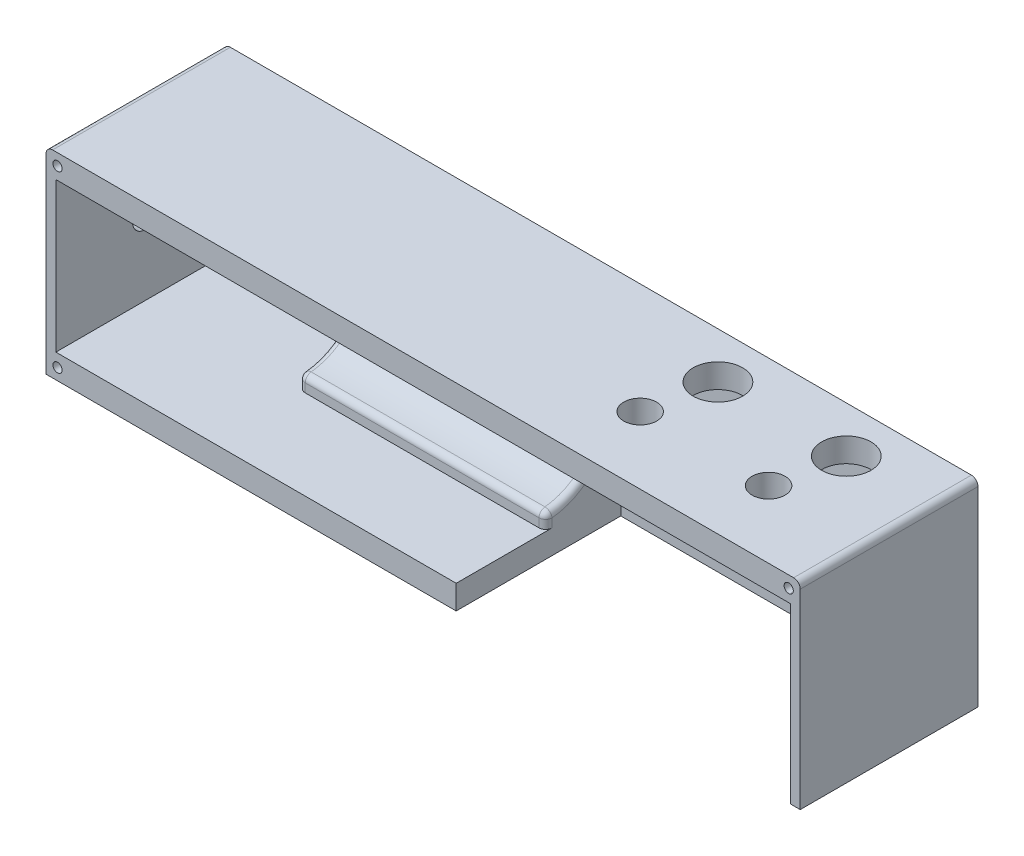
from build123d import *
from build123d.topology import SkipClean

# Parameters (mm, degrees)
SKETCH_1_W          = 46.6
SKETCH_1_H          = 7.3
EXTRUDE_1_DEPTH     = 54
EXTRUDE_1_2_DEPTH   = 54
SKETCH_2_W          = 46.6
SKETCH_2_H          = 45.4
EXTRUDE_2_DEPTH     = 4
SKETCH_3_W          = 54
SKETCH_3_H          = 60
EXTRUDE_3_DEPTH     = 3
SKETCH_4_R          = 3.871689423
CUT_EXTRUDE_1_DEPTH = 3
EXTRUDE_4_DEPTH     = 75
SKETCH_6_W          = 75
SKETCH_6_H          = 7.3
EXTRUDE_5_DEPTH     = 27.146082
SKETCH_7_W          = 4
SKETCH_7_H          = 60
EXTRUDE_6_DEPTH     = 104.5
SKETCH_8_R          = 1.4
CUT_EXTRUDE_2_DEPTH = 75
SKETCH_10_W         = 104.5
SKETCH_10_H         = 50
EXTRUDE_7_DEPTH     = 7.3
SKETCH_11_R         = 7.5
SKETCH_11_R_2       = 5
CUT_EXTRUDE_3_DEPTH = 16
SKETCH_12_W         = 54
SKETCH_12_H         = 60
EXTRUDE_8_DEPTH     = 3
SKETCH_13_R         = 1.4
CUT_EXTRUDE_4_DEPTH = 15
FILLET_1_R          = 2
FILLET_2_R          = 2


with BuildPart() as part:
    # ｽｹｯﾁ1 → ﾎﾞｽ - 押し出し1 (new body)
    with BuildSketch(Plane.XY):
        with Locations((26.3, 3.65)):
            Rectangle(SKETCH_1_W, SKETCH_1_H)
    extrude(amount=EXTRUDE_1_DEPTH)



with BuildPart() as body_2:
    # ｽｹｯﾁ1 → Extrude 1 2 (new body)
    with BuildSketch(Plane.XY):
        with Locations((26.3, 56.35)):
            Rectangle(SKETCH_1_W, SKETCH_1_H)
    extrude(amount=EXTRUDE_1_2_DEPTH)


with BuildPart() as part_1:
    add(part.part)

    add(body_2.part)  # ﾎﾞｽ - 押し出し2 merges body 2
    # ｽｹｯﾁ2 → ﾎﾞｽ - 押し出し2 (add)
    with BuildSketch(Plane(origin=(0, 0, 0), x_dir=(-1, 0, 0), z_dir=(0, 0, -1))):
        with Locations((-26.3, 30)):
            Rectangle(SKETCH_2_W, SKETCH_2_H)
    extrude(amount=-EXTRUDE_2_DEPTH)

    # ｽｹｯﾁ3 → ﾎﾞｽ - 押し出し3 (add)
    with BuildSketch(Plane.ZY.offset(-3)):
        with Locations((27, 30)):
            Rectangle(SKETCH_3_W, SKETCH_3_H)
    extrude(amount=EXTRUDE_3_DEPTH)

    # ｽｹｯﾁ4 → ｶｯﾄ - 押し出し1 (cut)
    with BuildSketch(Plane(origin=(3, 0, 0), x_dir=(0, 0, -1), z_dir=(1, 0, 0))):
        with Locations((-26.853917863, 29.837440161)):
            Circle(SKETCH_4_R)
    extrude(amount=-CUT_EXTRUDE_1_DEPTH, mode=Mode.SUBTRACT)

    # ｽｹｯﾁ5 → ﾎﾞｽ - 押し出し4 (add)
    with BuildSketch(Plane(origin=(49.6, 0, 0), x_dir=(0, 0, -1), z_dir=(1, 0, 0))):
        Polygon((0, 0), (0, 60), (-26.853917863, 60), (-26.853917863, 52.7), (-4, 52.7), (-4, 7.3), (-26.853917863, 7.3), (-26.853917863, 0), align=None)
        with BuildLine():
            Line((-4, 52.7), (-26.853917863, 52.7))
            Line((-26.853917863, 52.7), (-26.853917863, 47.837440161))
            ThreePointArc((-26.853917863, 47.837440161), (-14.125995802, 42.565362223), (-8.853917863, 29.837440161))
            ThreePointArc((-8.853917863, 29.837440161), (-14.125995802, 17.1095181), (-26.853917863, 11.837440161))
            Line((-26.853917863, 11.837440161), (-26.853917863, 7.3))
            Line((-26.853917863, 7.3), (-4, 7.3))
            Line((-4, 7.3), (-4, 52.7))
        make_face()
    extrude(amount=EXTRUDE_4_DEPTH)

    # ｽｹｯﾁ6 → ﾎﾞｽ - 押し出し5 (add)
    with BuildSketch(Plane.XY.offset(26.853917863)):
        with Locations((87.1, 56.35)):
            Rectangle(SKETCH_6_W, SKETCH_6_H)
        with Locations((87.1, 3.65)):
            Rectangle(SKETCH_6_W, SKETCH_6_H)
    extrude(amount=EXTRUDE_5_DEPTH)

    # ｽｹｯﾁ7 → ﾎﾞｽ - 押し出し6 (add)
    with BuildSketch(Plane(origin=(124.6, 0, 0), x_dir=(0, 0, -1), z_dir=(1, 0, 0))):
        with Locations((-2, 30)):
            Rectangle(SKETCH_7_W, SKETCH_7_H)
    extrude(amount=EXTRUDE_6_DEPTH)

    # ｽｹｯﾁ8 → ｶｯﾄ - 押し出し2 (cut)
    with BuildSketch(Plane.XY.offset(4)):
        with Locations((147.6, 31)):
            Circle(SKETCH_8_R)
        with Locations((180.6, 45)):
            Circle(SKETCH_8_R)
        with Locations((186.6, 31)):
            Circle(SKETCH_8_R)
        with Locations((219.6, 45)):
            Circle(SKETCH_8_R)
    extrude(amount=-CUT_EXTRUDE_2_DEPTH, mode=Mode.SUBTRACT)

    # ｽｹｯﾁ10 → ﾎﾞｽ - 押し出し7 (add)
    with SkipClean():  # the faces are left unmerged after this step: merging them gives an invalid solid
        with BuildSketch(Plane(origin=(0, 60, 0), x_dir=(1, 0, 0), z_dir=(0, 1, 0))):
            with Locations((176.85, -29)):
                Rectangle(SKETCH_10_W, SKETCH_10_H)
        extrude(amount=-EXTRUDE_7_DEPTH)

    # ｽｹｯﾁ11 → ｶｯﾄ - 押し出し3 (cut)
    with SkipClean():  # the faces are left unmerged after this step: merging them gives an invalid solid
        with BuildSketch(Plane(origin=(0, 52.7, 0), x_dir=(-1, 0, 0), z_dir=(0, -1, 0))):
            with Locations(Location((-164.1, -14, 0), (0, 0, 90))):
                Circle(SKETCH_11_R)
            with Locations(Location((-203.1, -14, 0), (0, 0, 90))):
                Circle(SKETCH_11_R)
            with Locations(Location((-199.075229873, -33.590845449, 0), (0, 0, 90))):
                Circle(SKETCH_11_R_2)
            with Locations(Location((-160.075229873, -33.590845449, 0), (0, 0, 90))):
                Circle(SKETCH_11_R_2)
        extrude(amount=-CUT_EXTRUDE_3_DEPTH, mode=Mode.SUBTRACT)

    # ｽｹｯﾁ12 → ﾎﾞｽ - 押し出し8 (add)
    with BuildSketch(Plane(origin=(229.1, 0, 0), x_dir=(0, 0, -1), z_dir=(1, 0, 0))):
        with Locations((-27, 30)):
            Rectangle(SKETCH_12_W, SKETCH_12_H)
    extrude(amount=-EXTRUDE_8_DEPTH)

    # ｽｹｯﾁ13 → ｶｯﾄ - 押し出し4 (cut)
    with BuildSketch(Plane.XY.offset(54)):
        with Locations((3.5, 3.5)):
            Circle(SKETCH_13_R)
        with Locations((3.5, 56.5)):
            Circle(SKETCH_13_R)
        with Locations((225.6, 56.5)):
            Circle(SKETCH_13_R)
    extrude(amount=-CUT_EXTRUDE_4_DEPTH, mode=Mode.SUBTRACT)

    # ﾌｨﾚｯﾄ1
    fillet_1_edges = [part_1.edges().sort_by_distance(p)[0] for p in [
        (49.6, 29.837440161, 8.853917863),
        (49.6, 50.268720081, 26.853917863),
        (124.6, 29.837440161, 8.853917863),
        (87.1, 47.837440161, 26.853917863),
        (49.6, 9.568720081, 26.853917863),
        (87.1, 11.837440161, 26.853917863),
        (124.6, 9.568720081, 26.853917863),
        (124.6, 50.268720081, 26.853917863),
    ]]
    fillet(fillet_1_edges, radius=FILLET_1_R)

    # ﾌｨﾚｯﾄ2
    fillet_2_edges = [part_1.edges().sort_by_distance(p)[0] for p in [
        (229.1, 60, 27),
        (0, 60, 27),
    ]]
    fillet(fillet_2_edges, radius=FILLET_2_R)


solid = part_1.part
